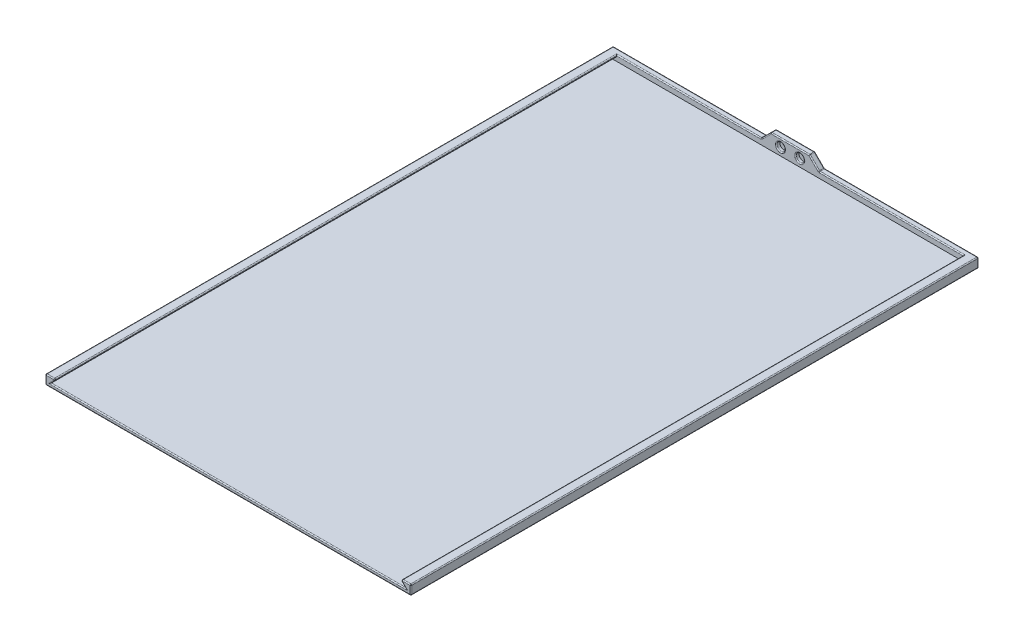
from build123d import *

# Parameters (mm, degrees)
BOSS_EXTRUDE1_DEPTH = 292.15
BOSS_EXTRUDE2_DEPTH = 3
SKETCH1_5_R         = 2.15
CUT_EXTRUDE1_DEPTH  = 1.8
FILLET1_R           = 0.5


with BuildPart() as part:
    # Sketch1 → Boss-Extrude1 (new body)
    with BuildSketch(Plane.XY):
        Polygon((4.8, 3), (0, 3), (0, -2), (95, -2), (95, 0), (3, 0), (2.717157288, 0), (2.858578644, 0.141421356), (4.8, 2.082842712), align=None)
    extrude(amount=BOSS_EXTRUDE1_DEPTH)

    # Sketch1<3> → Boss-Extrude2 (add)
    with BuildSketch(Plane.XY):
        Polygon((0, 3), (0, -2), (95, -2), (95, 8), (85, 8), (80, 3), align=None)
    extrude(amount=-BOSS_EXTRUDE2_DEPTH)

    # Sketch1<5> → Cut-Extrude1 (cut)
    with BuildSketch(Plane.XY):
        with Locations((90, 4)):
            Circle(SKETCH1_5_R)
    extrude(amount=-CUT_EXTRUDE1_DEPTH, mode=Mode.SUBTRACT)

    # Mirror1: part across plane


with BuildPart() as part_1:
    add(part.part)
    add(part.part.mirror(Plane(origin=(95, 0, 292.15), x_dir=(0, 0, 1), z_dir=(-1, 0, 0))))

    # Fillet1
    fillet1_edges = [part_1.edges().sort_by_distance(p)[0] for p in [
        (186.241421356, 1.041421356, 292.15),
        (185.2, 2.541421356, 292.15),
        (187.6, 3, 292.15),
        (190, 0.5, 292.15),
        (95, -2, 292.15),
        (0, 0.5, 292.15),
        (2.4, 3, 292.15),
        (4.8, 2.541421356, 292.15),
        (3.758578644, 1.041421356, 292.15),
        (95, 0, 292.15),
        (107.5, 5.5, 0),
        (82.5, 5.5, 0),
        (190, -2, 144.575),
        (0, -2, 144.575),
        (82.5, 5.5, -3),
        (0, 0.5, -3),
        (95, -2, -3),
        (190, 0.5, -3),
        (107.5, 5.5, -3),
        (85, 8, -1.5),
        (95, 8, -3),
        (105, 8, -1.5),
        (95, 8, 0),
        (147.6, 3, 0),
        (110, 3, -1.5),
        (150, 3, -3),
        (190, 3, 144.575),
        (185.2, 3, 146.075),
        (0, 3, 144.575),
        (40, 3, -3),
        (80, 3, -1.5),
        (42.4, 3, 0),
        (4.8, 3, 146.075),
        (4.8, 2.082842712, 146.075),
        (185.2, 2.082842712, 146.075),
        (87.85, 4, 0),
        (102.15, 4, 0),
    ]]
    fillet(fillet1_edges, radius=FILLET1_R)


solid = part_1.part
